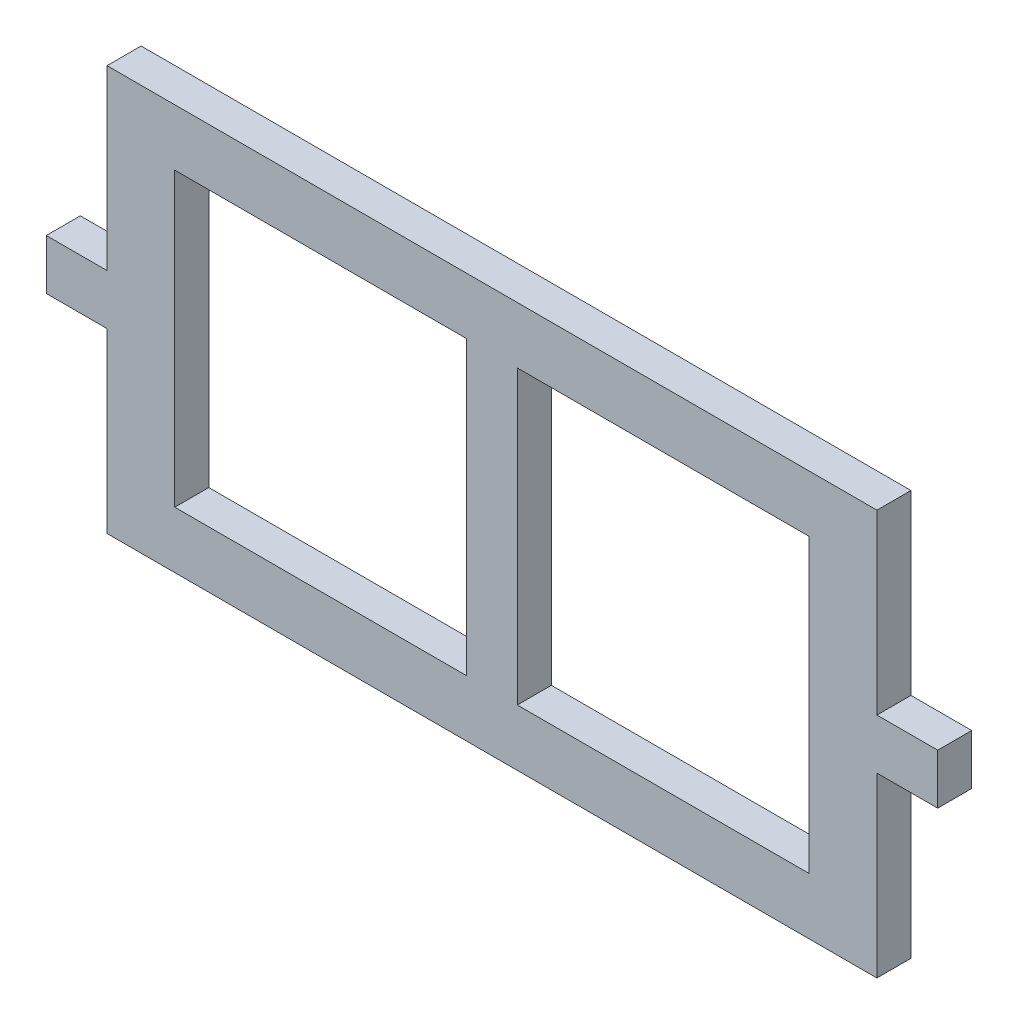
from build123d import *

# Parameters (mm, degrees)
SKETCH1_W           = 241.3
SKETCH1_H           = 127
BOSS_EXTRUDE1_DEPTH = 10.668
SKETCH3_W           = 91.5
SKETCH3_H           = 91.5
CUT_EXTRUDE1_DEPTH  = 137.757006124
SKETCH4_W           = 19.05
SKETCH4_H           = 15.748
BOSS_EXTRUDE2_DEPTH = 10.668


with BuildPart() as part:
    # Sketch1 → Boss-Extrude1 (new body)
    with BuildSketch(Plane.XY):
        Rectangle(SKETCH1_W, SKETCH1_H)
    extrude(amount=BOSS_EXTRUDE1_DEPTH)

    # Sketch3 → Cut-Extrude1 (cut, through all)
    with BuildSketch(Plane.XY.offset(10.668)):
        with Locations((-53.6875, 0)):
            Rectangle(SKETCH3_W, SKETCH3_H)
        with Locations((53.6875, 0)):
            Rectangle(SKETCH3_W, SKETCH3_H)
    extrude(amount=-CUT_EXTRUDE1_DEPTH, mode=Mode.SUBTRACT)

    # Sketch4 → Boss-Extrude2 (add, through all)
    with BuildSketch(Plane.XY.offset(10.668)):
        with Locations((-130.175, 0)):
            Rectangle(SKETCH4_W, SKETCH4_H)
    boss_extrude2 = extrude(amount=-BOSS_EXTRUDE2_DEPTH)

    # Mirror1: Boss-Extrude2 across plane
    add(boss_extrude2.mirror(Plane(origin=(0, 0, 0), x_dir=(0, 0, 1), z_dir=(1, 0, 0))))


solid = part.part
